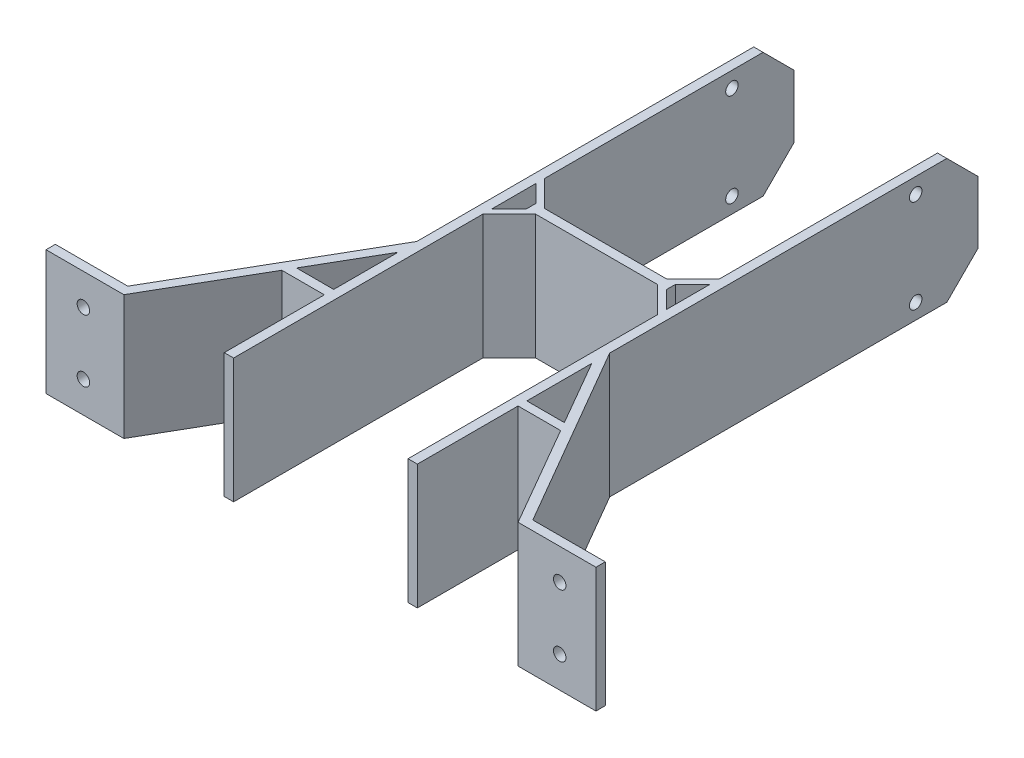
from build123d import *

# Parameters (mm, degrees)
SALIENTE_EXTRUIR1_DEPTH = 40
CROQUIS2_R              = 2
CORTAR_EXTRUIR1_DEPTH   = 155.645237674
CHAFL_N1_SIZE           = 10
CROQUIS3_R              = 2
CORTAR_EXTRUIR2_DEPTH   = 202.82259614


with BuildPart() as part:
    # Croquis1 → Saliente-Extruir1 (new body)
    with BuildSketch(Plane(origin=(0, 0, 0), x_dir=(1, 0, 0), z_dir=(0, 1, 0))):
        Polygon((-28, 9.865463386), (-19.634536614, 1.5), (19.634536614, 1.5), (28, 9.865463386), (28, 90), (31, 90), (31, -28.243932152), (65.068681447, -87), (88.33663064, -87), (88.33663064, -90), (63.33663064, -90), (44.669393136, -57.667396206), (31, -57.667396206), (31, -90), (28, -90), (28, -9.865463386), (19.634536614, -1.5), (-19.634536614, -1.5), (-28, -9.865463386), (-28, -90), (-31, -90), (-31, -57.856759015), (-44.669393136, -57.856759015), (-63.227301971, -90), (-88.227301971, -90), (-88.227301971, -87), (-64.959352778, -87), (-31, -28.180675596), (-31, 90), (-28, 90), align=None)
        Polygon((-28, -7.037036261), (-22.454974268, -1.492010529), (-22.454974268, 1.492010529), (-28, 7.037036261), align=None, mode=Mode.SUBTRACT)
        Polygon((28, -7.011712537), (22.454974268, -1.466686806), (22.454974268, 1.466686806), (28, 7.011712537), align=None, mode=Mode.SUBTRACT)
        Polygon((31, -33.991312786), (43.046670997, -54.856759015), (31, -54.856759015), align=None, mode=Mode.SUBTRACT)
        Polygon((-31, -34.180675596), (-42.937342328, -54.856759015), (-31, -54.856759015), align=None, mode=Mode.SUBTRACT)
    extrude(amount=SALIENTE_EXTRUIR1_DEPTH)

    # Croquis2 → Cortar-Extruir1 (cut, through all)
    with BuildSketch(Plane(origin=(31, 0, 0), x_dir=(0, 0, -1), z_dir=(1, 0, 0))):
        with Locations((70, 35)):
            Circle(CROQUIS2_R)
        with Locations((70, 5)):
            Circle(CROQUIS2_R)
    extrude(amount=-CORTAR_EXTRUIR1_DEPTH, mode=Mode.SUBTRACT)

    # Chaflán1
    chafl_n1_edges = [part.edges().sort_by_distance(p)[0] for p in [
        (29.5, 40, -90),
        (-29.5, 40, -90),
        (29.5, 0, -90),
        (-29.5, 0, -90),
    ]]
    chamfer(chafl_n1_edges, length=CHAFL_N1_SIZE)

    # Croquis3 → Cortar-Extruir2 (cut, through all)
    with BuildSketch(Plane(origin=(0, 0, 87), x_dir=(-1, 0, 0), z_dir=(0, 0, -1))):
        with Locations((-76.702656044, 30)):
            Circle(CROQUIS3_R)
        with Locations((-76.702656044, 10)):
            Circle(CROQUIS3_R)
        with Locations((76.227301971, 30)):
            Circle(CROQUIS3_R)
        with Locations((76.227301971, 10)):
            Circle(CROQUIS3_R)
    extrude(amount=-CORTAR_EXTRUIR2_DEPTH, mode=Mode.SUBTRACT)


solid = part.part
